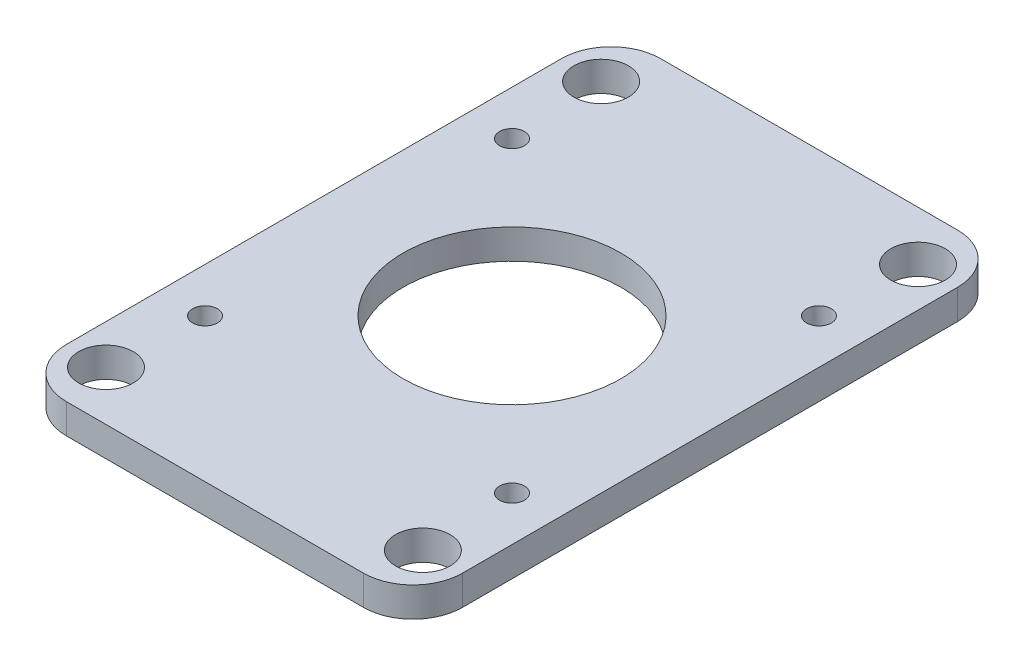
from build123d import *

# Parameters (mm, degrees)
SKETCH1_W           = 40
SKETCH1_H           = 60
SKETCH1_R           = 2.75
SKETCH1_R_2         = 1.25
SKETCH1_R_3         = 11
SKETCH1_R_4         = 4
BOSS_EXTRUDE1_DEPTH = 3
FILLET1_R           = 5


with BuildPart() as part:
    # Sketch1 → Boss-Extrude1 (new body)
    # profile 1 of 3: a face of its own
    with BuildSketch(Plane(origin=(0, 0, 0), x_dir=(1, 0, 0), z_dir=(0, 1, 0))):
        Rectangle(SKETCH1_W, SKETCH1_H)
        with Locations(Location((16, -25, 0), (0, 0, 270))):
            Circle(SKETCH1_R, mode=Mode.SUBTRACT)
        with Locations(Location((-16, -25, 0), (0, 0, 270))):
            Circle(SKETCH1_R, mode=Mode.SUBTRACT)
        with Locations(Location((16, 25, 0), (0, 0, 270))):
            Circle(SKETCH1_R, mode=Mode.SUBTRACT)
        with Locations(Location((-16, 25, 0), (0, 0, 270))):
            Circle(SKETCH1_R, mode=Mode.SUBTRACT)
        with Locations(Location((15.5, -15.5, 0), (0, 0, 270))):
            Circle(SKETCH1_R_2, mode=Mode.SUBTRACT)
        with Locations(Location((15.5, 15.5, 0), (0, 0, 270))):
            Circle(SKETCH1_R_2, mode=Mode.SUBTRACT)
        with Locations(Location((-15.5, 15.5, 0), (0, 0, 270))):
            Circle(SKETCH1_R_2, mode=Mode.SUBTRACT)
        with Locations(Location((-15.5, -15.5, 0), (0, 0, 270))):
            Circle(SKETCH1_R_2, mode=Mode.SUBTRACT)
        with Locations(Location((0, 0, 0), (0, 0, 270))):
            Circle(SKETCH1_R_3, mode=Mode.SUBTRACT)
        with Locations((0, 25)):
            Circle(SKETCH1_R_4, mode=Mode.SUBTRACT)
        with Locations((0, -25)):
            Circle(SKETCH1_R_4, mode=Mode.SUBTRACT)
    # profile 2 of 3: a face of its own
    with BuildSketch(Plane(origin=(0, 0, 0), x_dir=(1, 0, 0), z_dir=(0, 1, 0))):
        with Locations((0, 25)):
            Circle(SKETCH1_R_4)
    # profile 3 of 3: a face of its own
    with BuildSketch(Plane(origin=(0, 0, 0), x_dir=(1, 0, 0), z_dir=(0, 1, 0))):
        with Locations((0, -25)):
            Circle(SKETCH1_R_4)
    extrude(amount=BOSS_EXTRUDE1_DEPTH)

    # Fillet1
    fillet1_edges = [part.edges().sort_by_distance(p)[0] for p in [
        (20, 1.5, 30),
        (-20, 1.5, 30),
        (-20, 1.5, -30),
        (20, 1.5, -30),
    ]]
    fillet(fillet1_edges, radius=FILLET1_R)


solid = part.part
